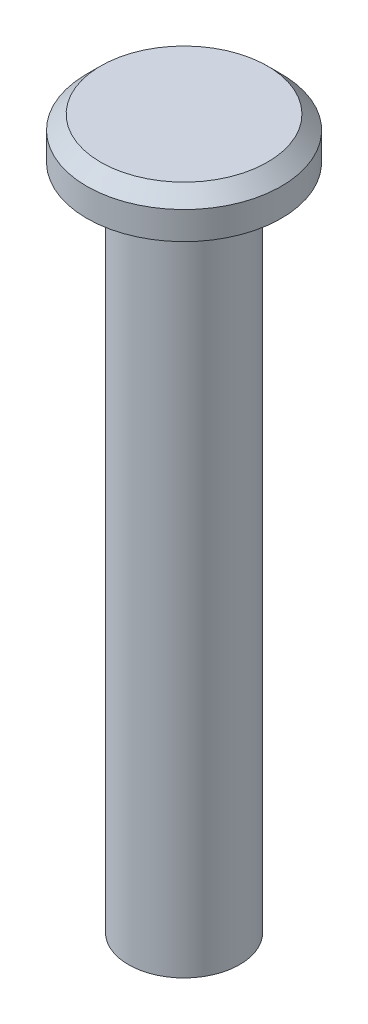
from build123d import *

# Parameters (mm, degrees)
SKETCH2_R           = 7
BOSS_EXTRUDE1_DEPTH = 3
SKETCH3_R           = 4
BOSS_EXTRUDE2_DEPTH = 48
CHAMFER1_SIZE       = 1


with BuildPart() as part:
    # Sketch2 → Boss-Extrude1 (new body)
    with BuildSketch(Plane(origin=(0, 0, 0), x_dir=(1, 0, 0), z_dir=(0, 1, 0))):
        with Locations(Location((0, 0, 0), (0, 0, 270))):
            Circle(SKETCH2_R)
    extrude(amount=BOSS_EXTRUDE1_DEPTH)

    # Sketch3 → Boss-Extrude2 (add)
    with BuildSketch(Plane.XZ):
        with Locations(Location((0, 0, 0), (0, 0, 270))):
            Circle(SKETCH3_R)
    extrude(amount=BOSS_EXTRUDE2_DEPTH)

    # Chamfer1
    chamfer1_edges = [part.edges().sort_by_distance(p)[0] for p in [
        (0, 3, -7),
    ]]
    chamfer(chamfer1_edges, length=CHAMFER1_SIZE)


solid = part.part
